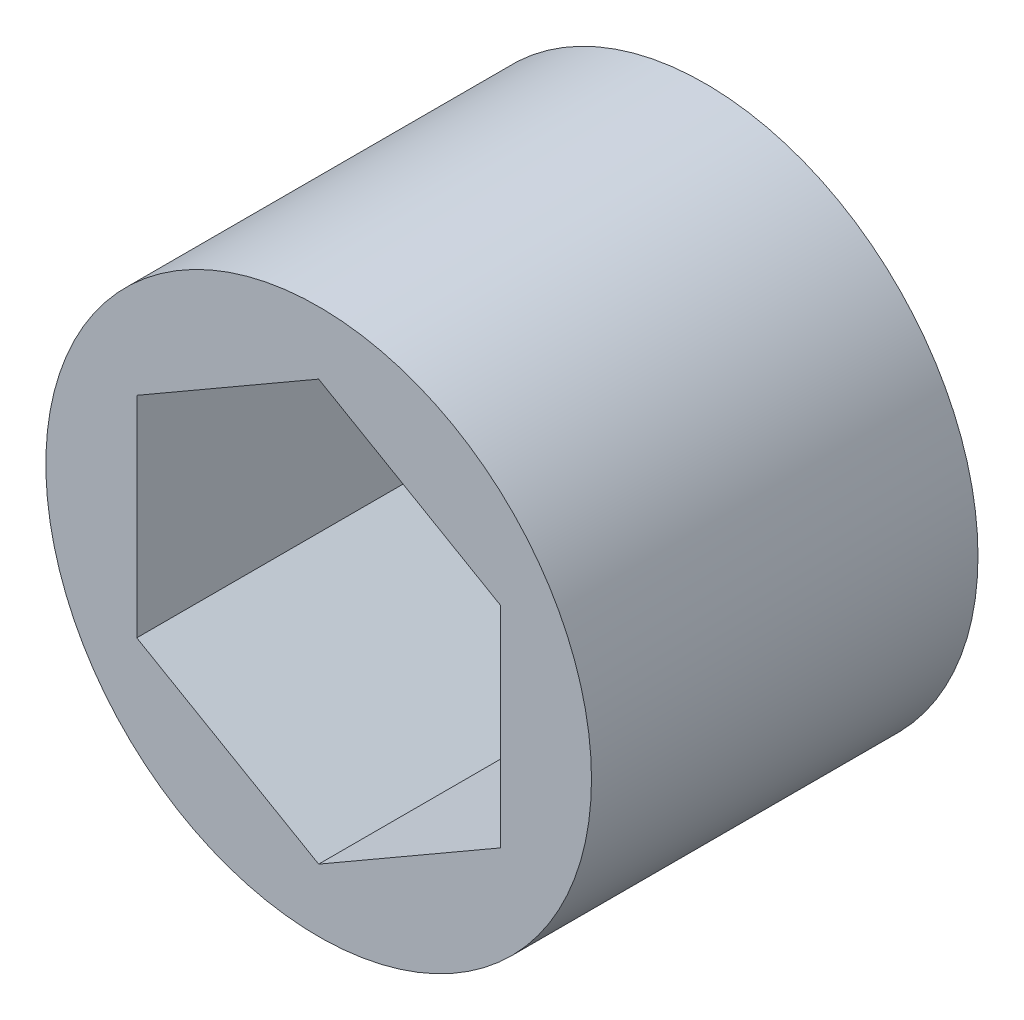
from build123d import *

# Parameters (mm, degrees)
SKETCH1_R           = 9.525
BOSS_EXTRUDE1_DEPTH = 6.746875


with BuildPart() as part:
    # Sketch1 → Boss-Extrude1 (new, symmetric)
    with BuildSketch(Plane.XY):
        Circle(SKETCH1_R)
        Polygon((0, 7.332348419), (-6.35, 3.666174209), (-6.35, -3.666174209), (0, -7.332348419), (6.35, -3.666174209), (6.35, 3.666174209), align=None, mode=Mode.SUBTRACT)
    extrude(amount=BOSS_EXTRUDE1_DEPTH, both=True)


solid = part.part
